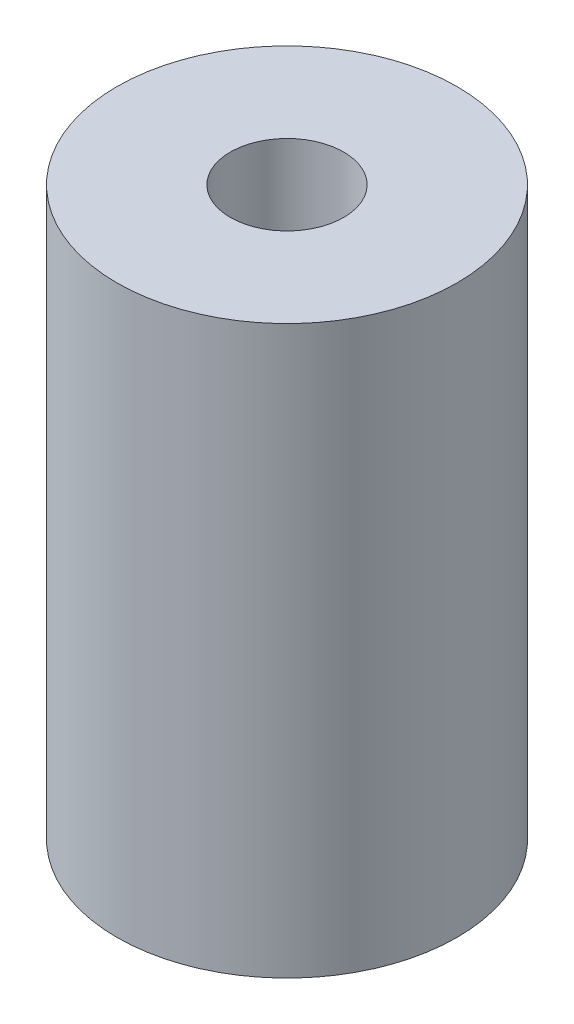
from build123d import *

# Parameters (mm, degrees)
SKETCH1_R           = 4.5
SKETCH1_R_2         = 1.5
BOSS_EXTRUDE1_DEPTH = 15


with BuildPart() as part:
    # Sketch1 → Boss-Extrude1 (new body)
    with BuildSketch(Plane(origin=(0, 0, 0), x_dir=(1, 0, 0), z_dir=(0, 1, 0))):
        with Locations(Location((0, 0, 0), (0, 0, 270))):
            Circle(SKETCH1_R)
        with Locations(Location((0, 0, 0), (0, 0, 270))):
            Circle(SKETCH1_R_2, mode=Mode.SUBTRACT)
    extrude(amount=BOSS_EXTRUDE1_DEPTH)


solid = part.part
